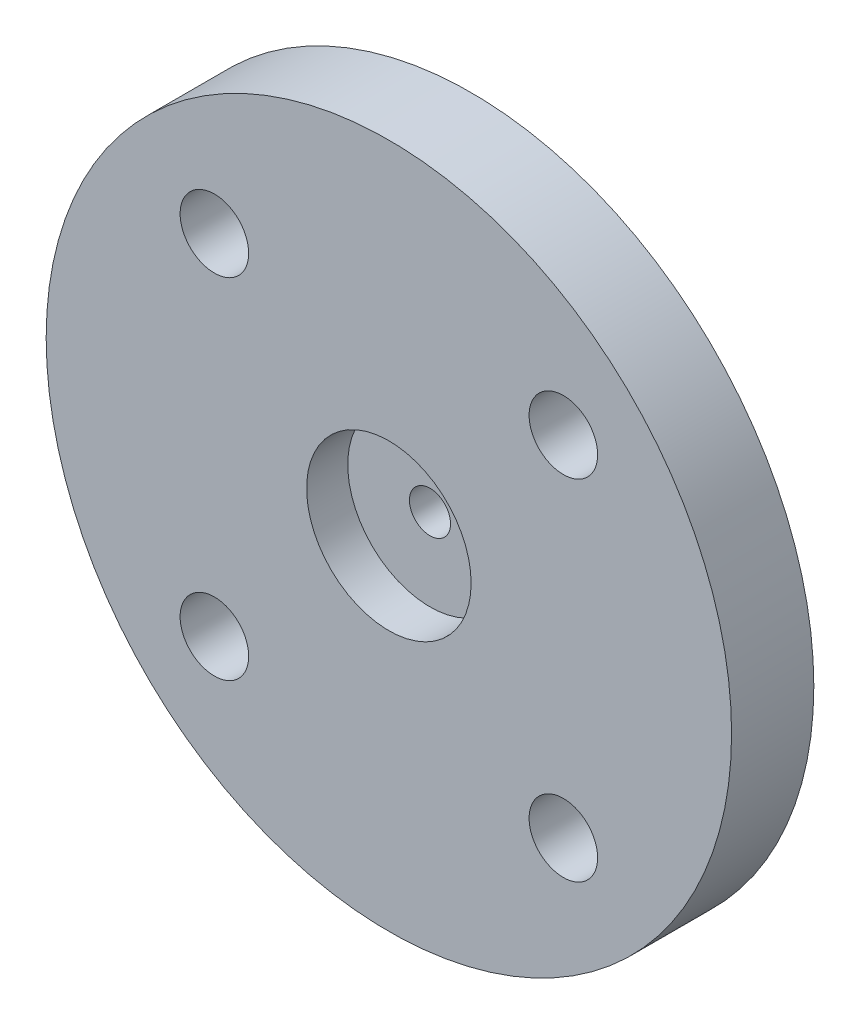
from build123d import *

# Parameters (mm, degrees)
SKETCH1_R           = 12.5
BOSS_EXTRUDE1_DEPTH = 1.5
SKETCH2_R           = 12.5
SKETCH2_R_2         = 0.75
BOSS_EXTRUDE2_DEPTH = 3
SKETCH3_R           = 1.25
CUT_EXTRUDE1_DEPTH  = 20.771458422
SKETCH4_R           = 12.5
SKETCH4_R_2         = 9.5
CUT_EXTRUDE2_DEPTH  = 1.5
SKETCH5_R           = 3
CUT_EXTRUDE3_DEPTH  = 1.5


with BuildPart() as part:
    # Sketch1 → Boss-Extrude1 (new body)
    with BuildSketch(Plane.XY):
        with Locations((0.807446417, 1.413031229)):
            Circle(SKETCH1_R)
        with BuildLine():
            Line((2.907446417, -2.065401928), (8.830836384, -1.541239144))
            ThreePointArc((8.830836384, -1.541239144), (9.200973023, -0.215222775), (9.353491615, 1.153009157))
            ThreePointArc((9.353491615, 1.153009157), (9.257446417, 1.413031229), (9.353491615, 1.673053302))
            ThreePointArc((9.353491615, 1.673053302), (9.200973023, 3.041285234), (8.830836384, 4.367301602))
            Line((8.830836384, 4.367301602), (2.907446417, 4.891464387))
            Line((2.907446417, 4.891464387), (2.907446417, 7.863031229))
            ThreePointArc((2.907446417, 7.863031229), (0.807446417, 9.963031229), (-1.292553583, 7.863031229))
            Line((-1.292553583, 7.863031229), (-1.292553583, 4.398412277))
            ThreePointArc((-1.292553583, 4.398412277), (-1.386241751, 4.330261461), (-1.477719845, 4.259171626))
            Line((-1.477719845, 4.259171626), (-7.361314725, 3.937678018))
            ThreePointArc((-7.361314725, 3.937678018), (-7.615427173, 2.881942556), (-7.733677844, 1.80251341))
            ThreePointArc((-7.733677844, 1.80251341), (-7.242553583, 1.413031229), (-7.733677844, 1.023549049))
            ThreePointArc((-7.733677844, 1.023549049), (-7.615427173, -0.055880097), (-7.361314725, -1.11161556))
            Line((-7.361314725, -1.11161556), (-1.477719845, -1.433109167))
            ThreePointArc((-1.477719845, -1.433109167), (-1.386241751, -1.504199002), (-1.292553583, -1.572349818))
            Line((-1.292553583, -1.572349818), (-1.292553583, -5.036968771))
            ThreePointArc((-1.292553583, -5.036968771), (0.807446417, -7.136968771), (2.907446417, -5.036968771))
            Line((2.907446417, -5.036968771), (2.907446417, -2.065401928))
        make_face(mode=Mode.SUBTRACT)
    extrude(amount=BOSS_EXTRUDE1_DEPTH)

    # Sketch2 → Boss-Extrude2 (add)
    with BuildSketch(Plane.XY.offset(1.5)):
        with Locations((0.807446417, 1.413031229)):
            Circle(SKETCH2_R)
        with Locations((0.807446417, 1.413031229)):
            Circle(SKETCH2_R_2, mode=Mode.SUBTRACT)
    extrude(amount=BOSS_EXTRUDE2_DEPTH)

    # Sketch3 → Cut-Extrude1 (cut, through all)
    with BuildSketch(Plane.XY.offset(4.5)):
        with Locations((7.171407447, 7.77699226)):
            Circle(SKETCH3_R)
        with Locations((7.171407447, -4.950929801)):
            Circle(SKETCH3_R)
        with Locations((-5.556514614, -4.950929801)):
            Circle(SKETCH3_R)
        with Locations((-5.556514614, 7.77699226)):
            Circle(SKETCH3_R)
    extrude(amount=-CUT_EXTRUDE1_DEPTH, mode=Mode.SUBTRACT)

    # Sketch4 → Cut-Extrude2 (cut)
    with BuildSketch(Plane(origin=(0, 0, 0), x_dir=(-1, 0, 0), z_dir=(0, 0, -1))):
        with Locations((-0.807446417, 1.413031229)):
            Circle(SKETCH4_R)
        with Locations((-0.807446417, 1.413031229)):
            Circle(SKETCH4_R_2, mode=Mode.SUBTRACT)
    extrude(amount=-CUT_EXTRUDE2_DEPTH, mode=Mode.SUBTRACT)

    # Sketch5 → Cut-Extrude3 (cut)
    with BuildSketch(Plane.XY.offset(4.5)):
        with Locations((0.807446417, 1.413031229)):
            Circle(SKETCH5_R)
    extrude(amount=-CUT_EXTRUDE3_DEPTH, mode=Mode.SUBTRACT)


solid = part.part
